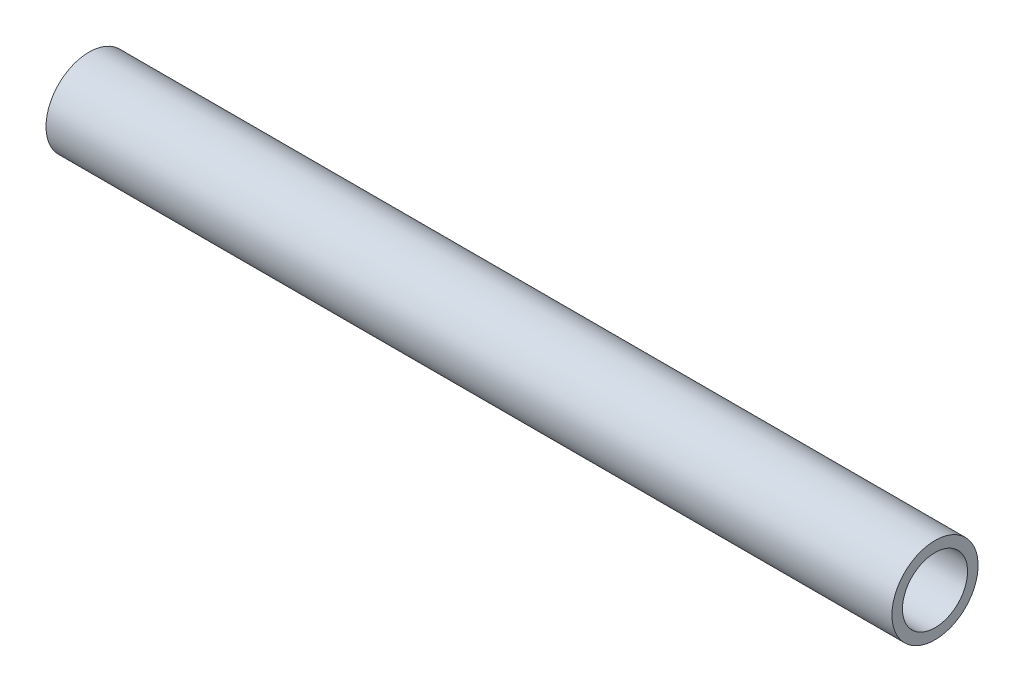
from build123d import *

# Parameters (mm, degrees)
HOSE_10_SKETCH_W = 165
HOSE_10_SKETCH_H = 2.05


with BuildPart() as part:
    # Hose_10 Sketch → Hose_10 (revolve)
    with BuildSketch(Plane.XY):
        with Locations((0, 7.375)):
            Rectangle(HOSE_10_SKETCH_W, HOSE_10_SKETCH_H)
    revolve(axis=Axis((-1000, 0, 0), (1, 0, 0)))


solid = part.part
